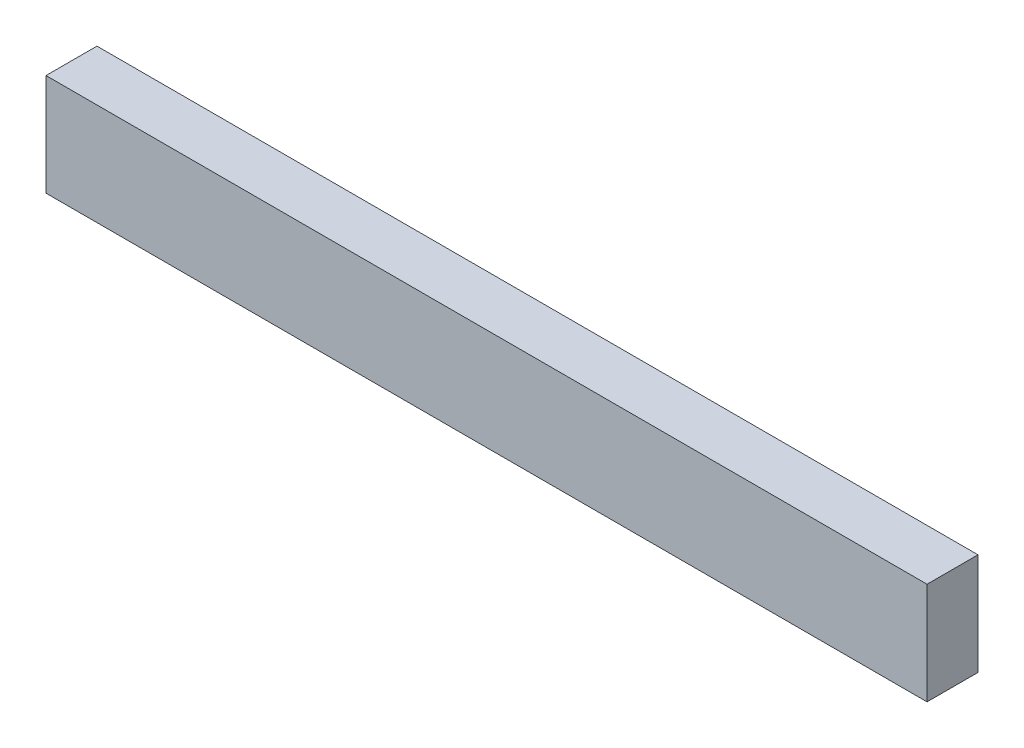
from build123d import *

# Parameters (mm, degrees)
ESQUISSE1_W        = 415
ESQUISSE1_H        = 48
BOSS_EXTRU_1_DEPTH = 12


with BuildPart() as part:
    # Esquisse1 → Boss.-Extru.1 (new, symmetric)
    with BuildSketch(Plane.XY):
        Rectangle(ESQUISSE1_W, ESQUISSE1_H)
    extrude(amount=BOSS_EXTRU_1_DEPTH, both=True)


solid = part.part
